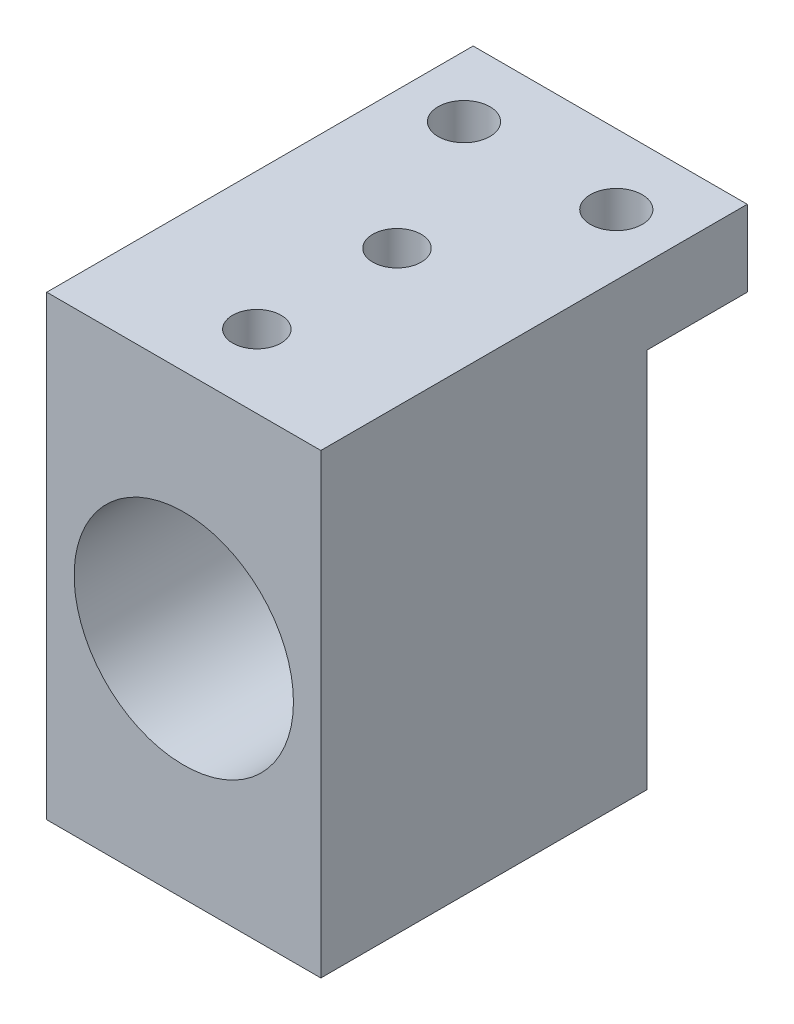
from build123d import *

# Parameters (mm, degrees)
SKETCH1_W                   = 22.86
SKETCH1_H                   = 35.56
BOSS_EXTRUDE1_DEPTH         = 38.1
SKETCH3_W                   = 22.86
SKETCH3_H                   = 8.382
CUT_EXTRUDE2_DEPTH          = 31.75
SKETCH4_R                   = 2.159
CUT_EXTRUDE3_DEPTH          = 6.35
SKETCH6_R                   = 9.144
CUT_EXTRUDE4_DEPTH          = 54.355116906
F_10_32_TAPPED_HOLE1_REACH  = 45.57
F_10_32_TAPPED_HOLE1_BORE_R = 2.0193


with BuildPart() as part:
    # Sketch1 → Boss-Extrude1 (new body)
    with BuildSketch(Plane(origin=(0, 0, 0), x_dir=(1, 0, 0), z_dir=(0, 1, 0))):
        Rectangle(SKETCH1_W, SKETCH1_H)
    extrude(amount=BOSS_EXTRUDE1_DEPTH)

    # Sketch3 → Cut-Extrude2 (cut)
    with BuildSketch(Plane.XZ):
        with Locations((0, -13.589)):
            Rectangle(SKETCH3_W, SKETCH3_H)
    extrude(amount=-CUT_EXTRUDE2_DEPTH, mode=Mode.SUBTRACT)

    # Sketch4 → Cut-Extrude3 (cut)
    with BuildSketch(Plane(origin=(0, 38.1, 0), x_dir=(1, 0, 0), z_dir=(0, 1, 0))):
        with Locations(Location((-6.35, 11.938, 0), (0, 0, 270))):
            Circle(SKETCH4_R)
        with Locations(Location((6.35, 11.938, 0), (0, 0, 90))):
            Circle(SKETCH4_R)
    extrude(amount=-CUT_EXTRUDE3_DEPTH, mode=Mode.SUBTRACT)

    # Sketch6 → Cut-Extrude4 (cut, through all)
    with BuildSketch(Plane.XY.offset(17.78)):
        with Locations((0, 18.796)):
            Circle(SKETCH6_R)
    extrude(amount=-CUT_EXTRUDE4_DEPTH, mode=Mode.SUBTRACT)

    # #10-32 Tapped Hole1 bore → #10-32 Tapped Hole1 (cut, up to next)
    with BuildSketch(Plane(origin=(0, 38.1, 0), x_dir=(1, 0, 0), z_dir=(0, 1, 0)), mode=Mode.PRIVATE) as f_10_32_tapped_hole1_sk1:
        Circle(F_10_32_TAPPED_HOLE1_BORE_R)
    f_10_32_tapped_hole1_tool1 = extrude(f_10_32_tapped_hole1_sk1.sketch, amount=-F_10_32_TAPPED_HOLE1_REACH, mode=Mode.PRIVATE) & part.part
    # #10-32 Tapped Hole1 bore → #10-32 Tapped Hole1 (cut, up to next)
    with BuildSketch(Plane(origin=(0, 38.1, 0), x_dir=(1, 0, 0), z_dir=(0, 1, 0)), mode=Mode.PRIVATE) as f_10_32_tapped_hole1_sk2:
        with Locations((0, -11.689474191)):
            Circle(F_10_32_TAPPED_HOLE1_BORE_R)
    f_10_32_tapped_hole1_tool2 = extrude(f_10_32_tapped_hole1_sk2.sketch, amount=-F_10_32_TAPPED_HOLE1_REACH, mode=Mode.PRIVATE) & part.part
    add(f_10_32_tapped_hole1_tool1.solids().sort_by_distance((0, 38.1, 0))[0], mode=Mode.SUBTRACT)
    add(f_10_32_tapped_hole1_tool2.solids().sort_by_distance((0, 38.1, 11.689474))[0], mode=Mode.SUBTRACT)


solid = part.part
